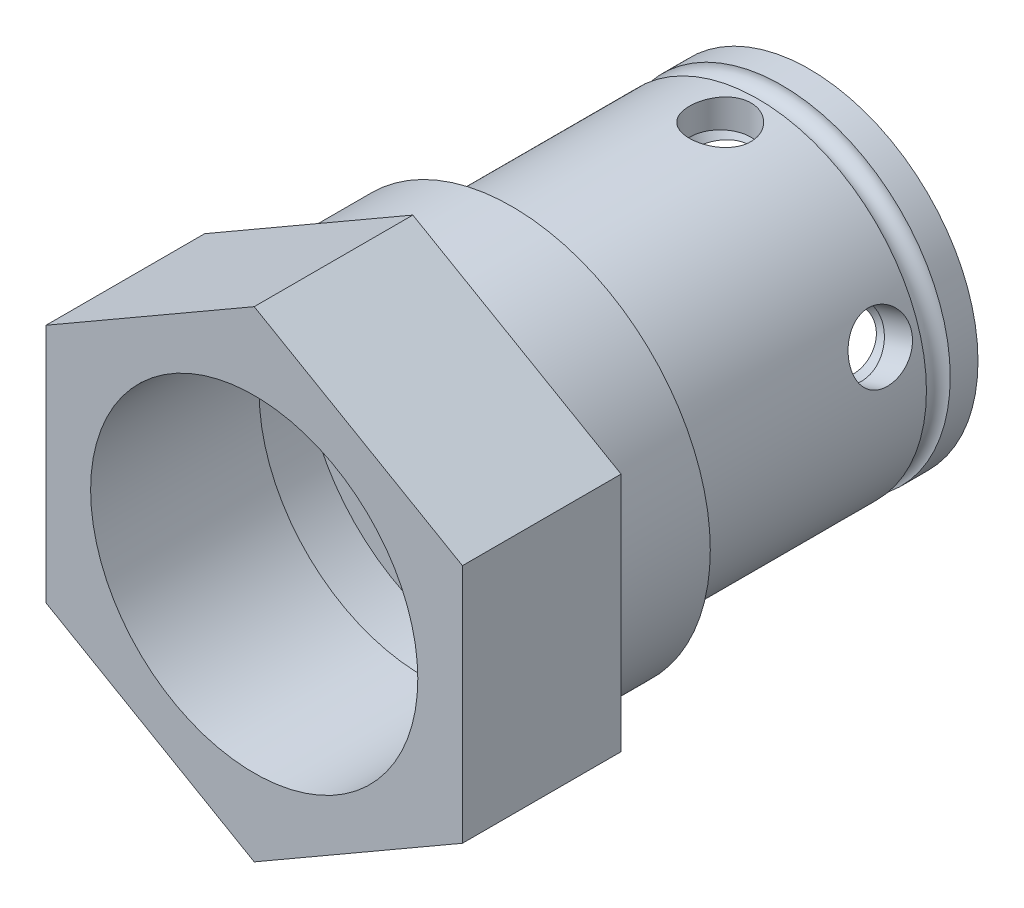
from build123d import *

# Parameters (mm, degrees)
SKETCH_2_R               = 8.5
EXTRUDE_1_DEPTH          = 15
SKETCH_3_R               = 10
EXTRUDE_2_DEPTH          = 5
EXTRUDE_3_DEPTH          = 8
SKETCH_6_R               = 6.75
CUT_EXTRUDE_1_DEPTH      = 15
SKETCH_7_R               = 5.9
CUT_EXTRUDE_2_DEPTH      = 22.960191256
M18X1_5_1_D              = 16.5
M18X1_5_1_DEPTH          = 7
M18X1_5_1_TIP            = 4.957100107
CUT_EXTRUDE_START        = 19.5
SKETCH_13_R              = 8.25
CUT_EXTRUDE_3_DEPTH      = 1.5
SWEEP_1_PROFILE_R        = 0.6
PATTERN_CIRCULAR_1_COUNT = 5


with BuildPart() as part:
    # 草图2 → 凸台-拉伸1 (new body)
    with BuildSketch(Plane.XY):
        Circle(SKETCH_2_R)
    extrude(amount=EXTRUDE_1_DEPTH)

    # 草图3 → 凸台-拉伸2 (add)
    with BuildSketch(Plane.XY.offset(15)):
        Circle(SKETCH_3_R)
    extrude(amount=EXTRUDE_2_DEPTH)

    # 草图4 → 凸台-拉伸3 (add)
    with BuildSketch(Plane.XY.offset(20)):
        Polygon((0, 12.124355653), (-10.5, 6.062177826), (-10.5, -6.062177826), (0, -12.124355653), (10.5, -6.062177826), (10.5, 6.062177826), align=None)
    extrude(amount=EXTRUDE_3_DEPTH)

    # 草图6 → 切除-拉伸1 (cut)
    with BuildSketch(Plane(origin=(0, 0, 0), x_dir=(-1, 0, 0), z_dir=(0, 0, -1))):
        Circle(SKETCH_6_R)
    extrude(amount=-CUT_EXTRUDE_1_DEPTH, mode=Mode.SUBTRACT)

    # 草图7 → 切除-拉伸2 (cut, through all)
    with BuildSketch(Plane(origin=(0, 0, 15), x_dir=(-1, 0, 0), z_dir=(0, 0, -1))):
        Circle(SKETCH_7_R)
    extrude(amount=-CUT_EXTRUDE_2_DEPTH, mode=Mode.SUBTRACT)

    # 草图8 → 切除-旋转1 (revolve, cut)
    with BuildSketch(Plane(origin=(0, 0, 0), x_dir=(0, 0, -1), z_dir=(1, 0, 0)), mode=Mode.PRIVATE) as cut_revolve_1_sk:
        Polygon((-16.7, 0), (-16.7, -6.9), (-16.5, -6.9), (-16.5, -9), (-19.5, -9), (-19.5, 0), align=None)
    revolve(cut_revolve_1_sk.sketch.rotate(Axis((0, 0, 5.279548329), (0, 0, 1)), 270), axis=Axis((0, 0, 5.279548329), (0, 0, 1)), mode=Mode.SUBTRACT)

    # M18x1.5 螺纹孔1
    with Locations(Plane.XY.offset(28)):
        with Locations((0, 0)):
            Hole(M18X1_5_1_D / 2, depth=M18X1_5_1_DEPTH)
            with Locations((0, 0, -(M18X1_5_1_DEPTH + M18X1_5_1_TIP / 2))):  # 118° drill point
                Cone(0, M18X1_5_1_D / 2, M18X1_5_1_TIP, mode=Mode.SUBTRACT)

    # 草图13 → 切除-拉伸3 (cut)
    with BuildSketch(Plane.XY.offset(CUT_EXTRUDE_START)):
        Circle(SKETCH_13_R)
    extrude(amount=CUT_EXTRUDE_3_DEPTH, mode=Mode.SUBTRACT)

    # 切除-扫描1: sweep along a path in 草图14
    with BuildLine(Plane.XY.offset(2)) as sweep_1_path:
        CenterArc((0, 0), 8.5, 0, 360)
    # 切除-扫描1 profile (on start of the path) → 切除-扫描1 (sweep, cut)
    with BuildSketch(Plane(origin=(8.5, 0, 2), x_dir=(0, 0, 1), z_dir=(0, 1, 0))):
        Circle(SWEEP_1_PROFILE_R)
    sweep(path=sweep_1_path.line, mode=Mode.SUBTRACT)

    # 草图22 → Ø3.1 (3.1) 直径孔1 (revolve, cut)
    with BuildSketch(Plane(origin=(0, 8.5, 4.5), x_dir=(0, 0, 1), z_dir=(1, 0, 0))):
        Polygon((0, 0), (0, 4.184678752), (1.55, 1.5), (1.55, 0), align=None)
    hole_wizard_3_1_3_1_1 = revolve(axis=Axis((0, 14.85, 4.5), (0, -1, 0)), mode=Mode.SUBTRACT)

    # 阵列(圆周)1: Ø3.1 (3.1) 直径孔1 ×5 about axis
    pattern_circular_1_axis = Axis((0, 0, 0), (0, 0, 1))
    for i in range(1, PATTERN_CIRCULAR_1_COUNT):
        add(hole_wizard_3_1_3_1_1.rotate(pattern_circular_1_axis, i * 360 / PATTERN_CIRCULAR_1_COUNT), mode=Mode.SUBTRACT)


solid = part.part
